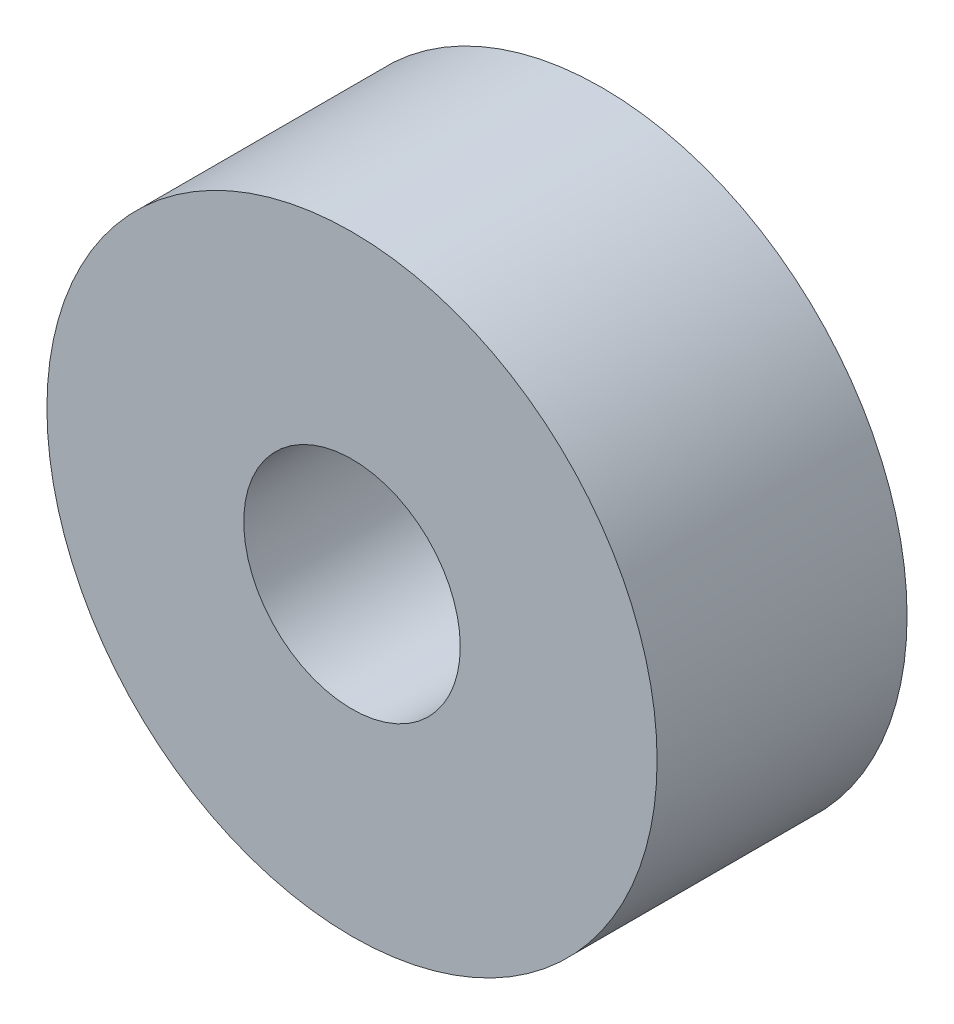
from build123d import *

# Parameters (mm, degrees)
SKETCH1_R           = 7.75
SKETCH1_R_2         = 2.75
BOSS_EXTRUDE1_DEPTH = 3.175


with BuildPart() as part:
    # Sketch1 → Boss-Extrude1 (new, symmetric)
    with BuildSketch(Plane.XY):
        Circle(SKETCH1_R)
        Circle(SKETCH1_R_2, mode=Mode.SUBTRACT)
    extrude(amount=BOSS_EXTRUDE1_DEPTH, both=True)


solid = part.part
